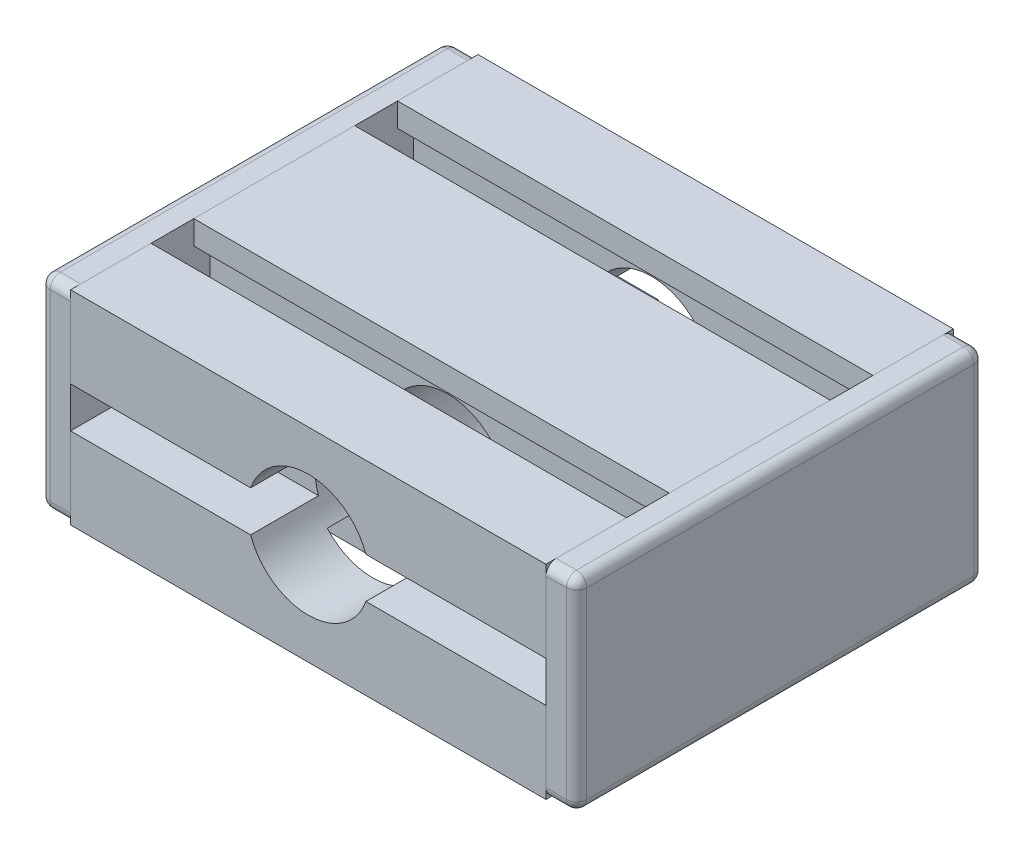
from build123d import *

# Parameters (mm, degrees)
BOSS_EXTRUDE1_DEPTH     = 35
SKETCH2_W               = 60
SKETCH2_H               = 30
BOSS_EXTRUDE2_DEPTH     = 4.5
SKETCH3_W               = 60
SKETCH3_H               = 30
BOSS_EXTRUDE3_DEPTH     = 4.5
FILLET1_R               = 1.5
FILLET2_R               = 1.5
CUT_EXTRUDE1_DEPTH      = 58.9676634
CUT_EXTRUDE1_DEPTH_BACK = 58.9676634
SKETCH4_R               = 9


with BuildPart() as part:
    # Sketch1 → Boss-Extrude1 (new, symmetric)
    with BuildSketch(Plane(origin=(0, 0, 0), x_dir=(0, 0, -1), z_dir=(1, 0, 0))):
        Polygon((11.85, 0), (-11.85, 0), (-11.85, 3.5), (-9.5, 3.5), (-9.5, 9), (-20.5, 9), (-20.5, 3.5), (-18.15, 3.5), (-18.15, 0), (-30, 0), (-30, 12), (-20, 12), (-20, 18), (-30, 18), (-30, 30), (-18.15, 30), (-18.15, 26.5), (-20.5, 26.5), (-20.5, 21), (-9.5, 21), (-9.5, 26.5), (-11.85, 26.5), (-11.85, 30), (11.85, 30), (11.85, 26.5), (9.5, 26.5), (9.5, 21), (20.5, 21), (20.5, 26.5), (18.15, 26.5), (18.15, 30), (30, 30), (30, 18), (20, 18), (20, 12), (30, 12), (30, 0), (18.15, 0), (18.15, 3.5), (20.5, 3.5), (20.5, 9), (9.5, 9), (9.5, 3.5), (11.85, 3.5), align=None)
    extrude(amount=BOSS_EXTRUDE1_DEPTH, both=True)

    # Sketch4 → Cut-Extrude1 (cut, two sides: drawn at the far end of the back side and taken through both)
    with BuildSketch(Plane.XY.offset(-CUT_EXTRUDE1_DEPTH_BACK)):
        with Locations(Location((0, 15, 0), (0, 0, 19.471220634))):
            Circle(SKETCH4_R)
    extrude(amount=CUT_EXTRUDE1_DEPTH + CUT_EXTRUDE1_DEPTH_BACK, mode=Mode.SUBTRACT)


with BuildPart() as body_2:
    # Sketch2 → Boss-Extrude2 (new body)
    with BuildSketch(Plane(origin=(35, 0, 0), x_dir=(0, 0, -1), z_dir=(1, 0, 0))):
        with Locations((0, 15)):
            Rectangle(SKETCH2_W, SKETCH2_H)
    extrude(amount=BOSS_EXTRUDE2_DEPTH)

    # Fillet2
    fillet2_edges = [body_2.edges().sort_by_distance(p)[0] for p in [
        (39.5, 15, -30),
        (39.5, 30, 0),
        (39.5, 15, 30),
        (37.25, 30, 30),
        (37.25, 30, -30),
        (37.25, 0, -30),
        (37.25, 0, 30),
        (39.5, 0, 0),
    ]]
    fillet(fillet2_edges, radius=FILLET2_R)


with BuildPart() as body_3:
    # Sketch3 → Boss-Extrude3 (new body)
    with BuildSketch(Plane.ZY.offset(35)):
        with Locations((0, 15)):
            Rectangle(SKETCH3_W, SKETCH3_H)
    extrude(amount=BOSS_EXTRUDE3_DEPTH)

    # Fillet1
    fillet1_edges = [body_3.edges().sort_by_distance(p)[0] for p in [
        (-39.5, 15, 30),
        (-39.5, 30, 0),
        (-39.5, 15, -30),
        (-37.25, 30, -30),
        (-37.25, 30, 30),
        (-37.25, 0, 30),
        (-37.25, 0, -30),
        (-39.5, 0, 0),
    ]]
    fillet(fillet1_edges, radius=FILLET1_R)


solid = Compound([part.part, body_2.part, body_3.part])
